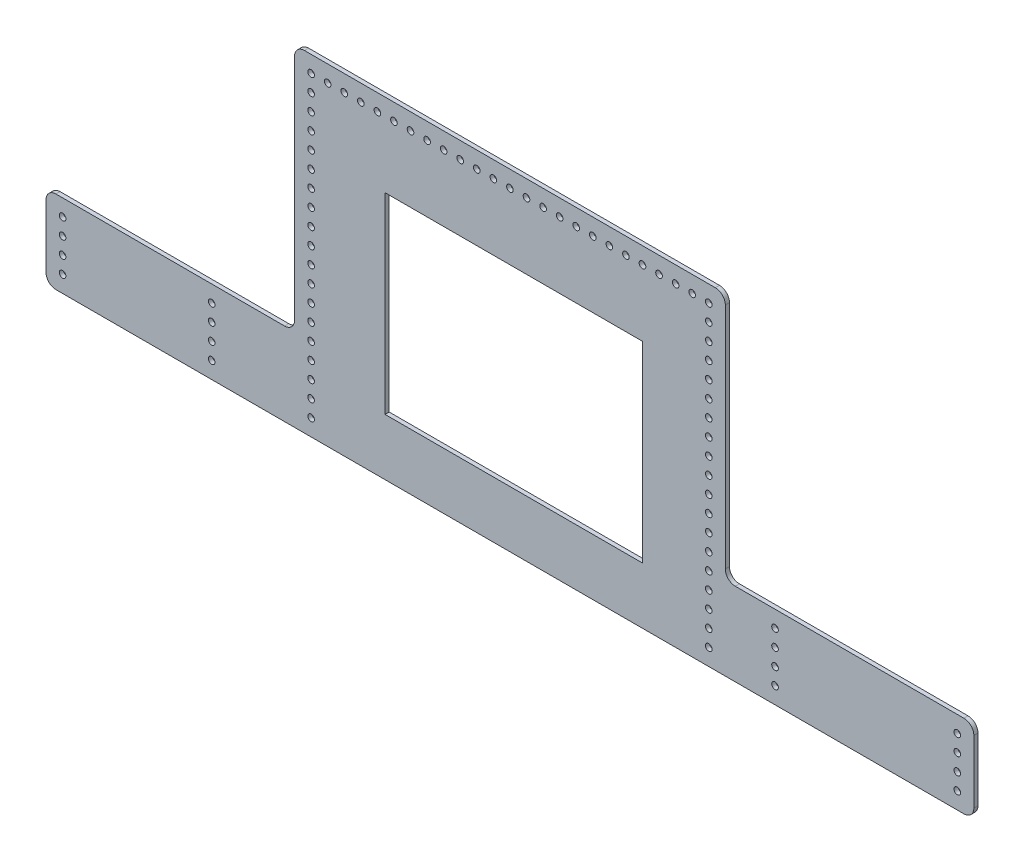
from build123d import *

# Parameters (mm, degrees)
SKETCH1_R           = 2.54
SKETCH1_W           = 197.300713287
SKETCH1_H           = 147.173619558
BOSS_EXTRUDE1_DEPTH = 3.175
FILLET1_R           = 7.62
FILLET2_R           = 7.62
FILLET3_R           = 7.62


with BuildPart() as part:
    # Sketch1 → Boss-Extrude1 (new body)
    with BuildSketch(Plane.XY):
        Polygon((-309.82006433, -121.697002141), (401.37993567, -121.697002141), (401.37993567, -58.197002141), (210.87993567, -58.197002141), (210.87993567, 132.302997859), (-119.32006433, 132.302997859), (-119.32006433, -58.197002141), (-309.82006433, -58.197002141), align=None)
        with Locations((-297.12006433, -70.897002141)):
            Circle(SKETCH1_R, mode=Mode.SUBTRACT)
        with Locations((388.67993567, -70.897002141)):
            Circle(SKETCH1_R, mode=Mode.SUBTRACT)
        with Locations((388.67993567, -83.597002141)):
            Circle(SKETCH1_R, mode=Mode.SUBTRACT)
        with Locations((388.67993567, -96.297002141)):
            Circle(SKETCH1_R, mode=Mode.SUBTRACT)
        with Locations((388.67993567, -108.997002141)):
            Circle(SKETCH1_R, mode=Mode.SUBTRACT)
        with Locations((-297.12006433, -83.597002141)):
            Circle(SKETCH1_R, mode=Mode.SUBTRACT)
        with Locations((-297.12006433, -96.297002141)):
            Circle(SKETCH1_R, mode=Mode.SUBTRACT)
        with Locations((-297.12006433, -108.997002141)):
            Circle(SKETCH1_R, mode=Mode.SUBTRACT)
        with Locations((-182.82006433, -70.897002141)):
            Circle(SKETCH1_R, mode=Mode.SUBTRACT)
        with Locations((248.97993567, -70.897002141)):
            Circle(SKETCH1_R, mode=Mode.SUBTRACT)
        with Locations((248.97993567, -83.597002141)):
            Circle(SKETCH1_R, mode=Mode.SUBTRACT)
        with Locations((248.97993567, -96.297002141)):
            Circle(SKETCH1_R, mode=Mode.SUBTRACT)
        with Locations((248.97993567, -108.997002141)):
            Circle(SKETCH1_R, mode=Mode.SUBTRACT)
        with Locations((-182.82006433, -83.597002141)):
            Circle(SKETCH1_R, mode=Mode.SUBTRACT)
        with Locations((-182.82006433, -96.297002141)):
            Circle(SKETCH1_R, mode=Mode.SUBTRACT)
        with Locations((-182.82006433, -108.997002141)):
            Circle(SKETCH1_R, mode=Mode.SUBTRACT)
        with Locations((-106.62006433, 119.602997859)):
            Circle(SKETCH1_R, mode=Mode.SUBTRACT)
        with Locations((-93.92006433, 119.602997859)):
            Circle(SKETCH1_R, mode=Mode.SUBTRACT)
        with Locations((-81.22006433, 119.602997859)):
            Circle(SKETCH1_R, mode=Mode.SUBTRACT)
        with Locations((-68.52006433, 119.602997859)):
            Circle(SKETCH1_R, mode=Mode.SUBTRACT)
        with Locations((-55.82006433, 119.602997859)):
            Circle(SKETCH1_R, mode=Mode.SUBTRACT)
        with Locations((-43.12006433, 119.602997859)):
            Circle(SKETCH1_R, mode=Mode.SUBTRACT)
        with Locations((-30.42006433, 119.602997859)):
            Circle(SKETCH1_R, mode=Mode.SUBTRACT)
        with Locations((-17.72006433, 119.602997859)):
            Circle(SKETCH1_R, mode=Mode.SUBTRACT)
        with Locations((-5.02006433, 119.602997859)):
            Circle(SKETCH1_R, mode=Mode.SUBTRACT)
        with Locations((7.67993567, 119.602997859)):
            Circle(SKETCH1_R, mode=Mode.SUBTRACT)
        with Locations((20.37993567, 119.602997859)):
            Circle(SKETCH1_R, mode=Mode.SUBTRACT)
        with Locations((33.07993567, 119.602997859)):
            Circle(SKETCH1_R, mode=Mode.SUBTRACT)
        with Locations((45.77993567, 119.602997859)):
            Circle(SKETCH1_R, mode=Mode.SUBTRACT)
        with Locations((58.47993567, 119.602997859)):
            Circle(SKETCH1_R, mode=Mode.SUBTRACT)
        with Locations((71.17993567, 119.602997859)):
            Circle(SKETCH1_R, mode=Mode.SUBTRACT)
        with Locations((83.87993567, 119.602997859)):
            Circle(SKETCH1_R, mode=Mode.SUBTRACT)
        with Locations((96.57993567, 119.602997859)):
            Circle(SKETCH1_R, mode=Mode.SUBTRACT)
        with Locations((109.27993567, 119.602997859)):
            Circle(SKETCH1_R, mode=Mode.SUBTRACT)
        with Locations((121.97993567, 119.602997859)):
            Circle(SKETCH1_R, mode=Mode.SUBTRACT)
        with Locations((134.67993567, 119.602997859)):
            Circle(SKETCH1_R, mode=Mode.SUBTRACT)
        with Locations((147.37993567, 119.602997859)):
            Circle(SKETCH1_R, mode=Mode.SUBTRACT)
        with Locations((160.07993567, 119.602997859)):
            Circle(SKETCH1_R, mode=Mode.SUBTRACT)
        with Locations((172.77993567, 119.602997859)):
            Circle(SKETCH1_R, mode=Mode.SUBTRACT)
        with Locations((185.47993567, 119.602997859)):
            Circle(SKETCH1_R, mode=Mode.SUBTRACT)
        with Locations((198.17993567, 119.602997859)):
            Circle(SKETCH1_R, mode=Mode.SUBTRACT)
        with Locations((198.17993567, 106.902997859)):
            Circle(SKETCH1_R, mode=Mode.SUBTRACT)
        with Locations((198.17993567, 94.202997859)):
            Circle(SKETCH1_R, mode=Mode.SUBTRACT)
        with Locations((198.17993567, 81.502997859)):
            Circle(SKETCH1_R, mode=Mode.SUBTRACT)
        with Locations((198.17993567, 68.802997859)):
            Circle(SKETCH1_R, mode=Mode.SUBTRACT)
        with Locations((198.17993567, 56.102997859)):
            Circle(SKETCH1_R, mode=Mode.SUBTRACT)
        with Locations((198.17993567, 43.402997859)):
            Circle(SKETCH1_R, mode=Mode.SUBTRACT)
        with Locations((198.17993567, 30.702997859)):
            Circle(SKETCH1_R, mode=Mode.SUBTRACT)
        with Locations((198.17993567, 18.002997859)):
            Circle(SKETCH1_R, mode=Mode.SUBTRACT)
        with Locations((198.17993567, 5.302997859)):
            Circle(SKETCH1_R, mode=Mode.SUBTRACT)
        with Locations((198.17993567, -7.397002141)):
            Circle(SKETCH1_R, mode=Mode.SUBTRACT)
        with Locations((198.17993567, -20.097002141)):
            Circle(SKETCH1_R, mode=Mode.SUBTRACT)
        with Locations((198.17993567, -32.797002141)):
            Circle(SKETCH1_R, mode=Mode.SUBTRACT)
        with Locations((198.17993567, -45.497002141)):
            Circle(SKETCH1_R, mode=Mode.SUBTRACT)
        with Locations((198.17993567, -58.197002141)):
            Circle(SKETCH1_R, mode=Mode.SUBTRACT)
        with Locations((198.17993567, -70.897002141)):
            Circle(SKETCH1_R, mode=Mode.SUBTRACT)
        with Locations((198.17993567, -83.597002141)):
            Circle(SKETCH1_R, mode=Mode.SUBTRACT)
        with Locations((198.17993567, -96.297002141)):
            Circle(SKETCH1_R, mode=Mode.SUBTRACT)
        with Locations((198.17993567, -108.997002141)):
            Circle(SKETCH1_R, mode=Mode.SUBTRACT)
        with Locations((-106.62006433, 106.902997859)):
            Circle(SKETCH1_R, mode=Mode.SUBTRACT)
        with Locations((-106.62006433, 94.202997859)):
            Circle(SKETCH1_R, mode=Mode.SUBTRACT)
        with Locations((-106.62006433, 81.502997859)):
            Circle(SKETCH1_R, mode=Mode.SUBTRACT)
        with Locations((-106.62006433, 68.802997859)):
            Circle(SKETCH1_R, mode=Mode.SUBTRACT)
        with Locations((-106.62006433, 56.102997859)):
            Circle(SKETCH1_R, mode=Mode.SUBTRACT)
        with Locations((-106.62006433, 43.402997859)):
            Circle(SKETCH1_R, mode=Mode.SUBTRACT)
        with Locations((-106.62006433, 30.702997859)):
            Circle(SKETCH1_R, mode=Mode.SUBTRACT)
        with Locations((-106.62006433, 18.002997859)):
            Circle(SKETCH1_R, mode=Mode.SUBTRACT)
        with Locations((-106.62006433, 5.302997859)):
            Circle(SKETCH1_R, mode=Mode.SUBTRACT)
        with Locations((-106.62006433, -7.397002141)):
            Circle(SKETCH1_R, mode=Mode.SUBTRACT)
        with Locations((-106.62006433, -20.097002141)):
            Circle(SKETCH1_R, mode=Mode.SUBTRACT)
        with Locations((-106.62006433, -32.797002141)):
            Circle(SKETCH1_R, mode=Mode.SUBTRACT)
        with Locations((-106.62006433, -45.497002141)):
            Circle(SKETCH1_R, mode=Mode.SUBTRACT)
        with Locations((-106.62006433, -58.197002141)):
            Circle(SKETCH1_R, mode=Mode.SUBTRACT)
        with Locations((-106.62006433, -70.897002141)):
            Circle(SKETCH1_R, mode=Mode.SUBTRACT)
        with Locations((-106.62006433, -83.597002141)):
            Circle(SKETCH1_R, mode=Mode.SUBTRACT)
        with Locations((-106.62006433, -96.297002141)):
            Circle(SKETCH1_R, mode=Mode.SUBTRACT)
        with Locations((-106.62006433, -108.997002141)):
            Circle(SKETCH1_R, mode=Mode.SUBTRACT)
        with Locations((48.729579027, -4.78381192)):
            Rectangle(SKETCH1_W, SKETCH1_H, mode=Mode.SUBTRACT)
    extrude(amount=BOSS_EXTRUDE1_DEPTH)

    # Fillet1
    fillet1_edges = [part.edges().sort_by_distance(p)[0] for p in [
        (210.87993567, -58.197002141, 1.5875),
    ]]
    fillet(fillet1_edges, radius=FILLET1_R)

    # Fillet2
    fillet2_edges = [part.edges().sort_by_distance(p)[0] for p in [
        (-309.82006433, -58.197002141, 1.5875),
        (210.87993567, 132.302997859, 1.5875),
        (401.37993567, -58.197002141, 1.5875),
        (401.37993567, -121.697002141, 1.5875),
        (-309.82006433, -121.697002141, 1.5875),
    ]]
    fillet(fillet2_edges, radius=FILLET2_R)

    # Fillet3
    fillet3_edges = [part.edges().sort_by_distance(p)[0] for p in [
        (-119.32006433, -58.197002141, 1.5875),
        (-119.32006433, 132.302997859, 1.5875),
    ]]
    fillet(fillet3_edges, radius=FILLET3_R)


solid = part.part
